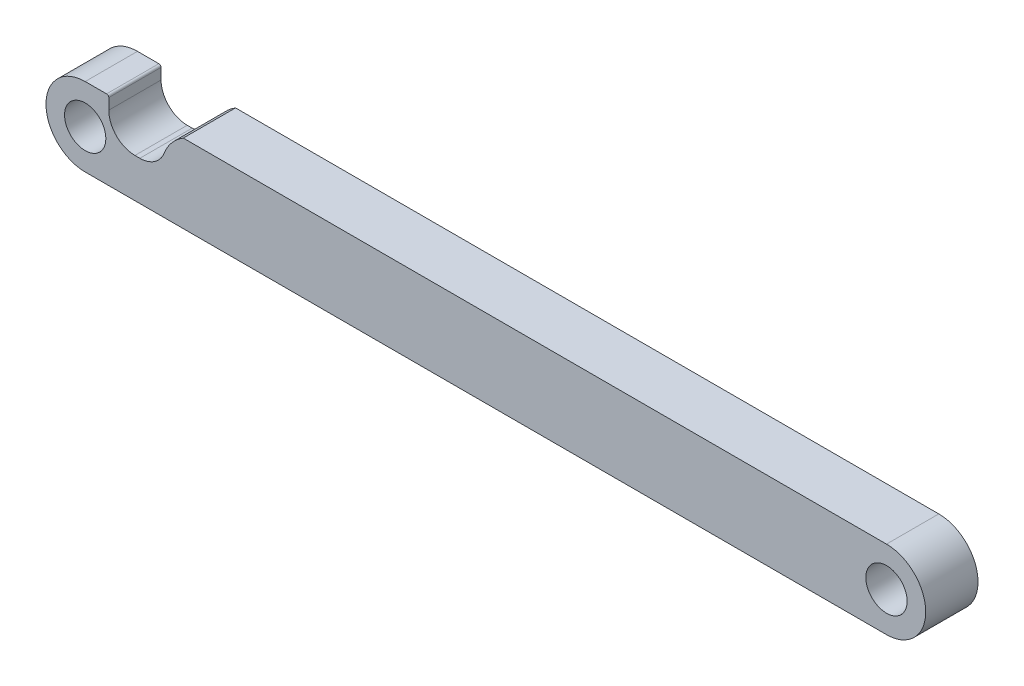
from build123d import *

# Parameters (mm, degrees)
SKETCH1_R           = 2.50825
BOSS_EXTRUDE1_DEPTH = 6.35


with BuildPart() as part:
    # Sketch1 → Boss-Extrude1 (new body)
    with BuildSketch(Plane.XY):
        with BuildLine():
            Line((-62.098423071, 33.11819072), (-62.098423071, 31.791851336))
            ThreePointArc((-62.098423071, 31.791851336), (-61.168487101, 29.546787305), (-58.923423071, 28.616851336))
            Line((-58.923423071, 28.616851336), (-58.325690241, 28.616851336))
            ThreePointArc((-58.325690241, 28.616851336), (-56.534748704, 29.17018137), (-55.368047634, 30.637305881))
            ThreePointArc((-55.368047634, 30.637305881), (-54.438487204, 32.200247817), (-53.054079396, 33.379351336))
            Line((-53.054079396, 33.379351336), (32.357826929, 33.379351336))
            ThreePointArc((32.357826929, 33.379351336), (35.725422975, 31.984447381), (37.120326929, 28.616851336))
            ThreePointArc((37.120326929, 28.616851336), (35.725422975, 25.24925529), (32.357826929, 23.854351336))
            Line((32.357826929, 23.854351336), (-64.964369517, 23.854351336))
            ThreePointArc((-64.964369517, 23.854351336), (-69.723087501, 28.61306932), (-64.964369517, 33.371787305))
            Line((-64.964369517, 33.371787305), (-62.36673293, 33.371787305))
            ThreePointArc((-62.36673293, 33.371787305), (-62.177950586, 33.302785823), (-62.098423071, 33.11819072))
        make_face()
        with Locations((32.357826929, 28.616851336)):
            Circle(SKETCH1_R, mode=Mode.SUBTRACT)
        with Locations((-64.964369517, 28.61306932)):
            Circle(SKETCH1_R, mode=Mode.SUBTRACT)
    extrude(amount=BOSS_EXTRUDE1_DEPTH)


solid = part.part
